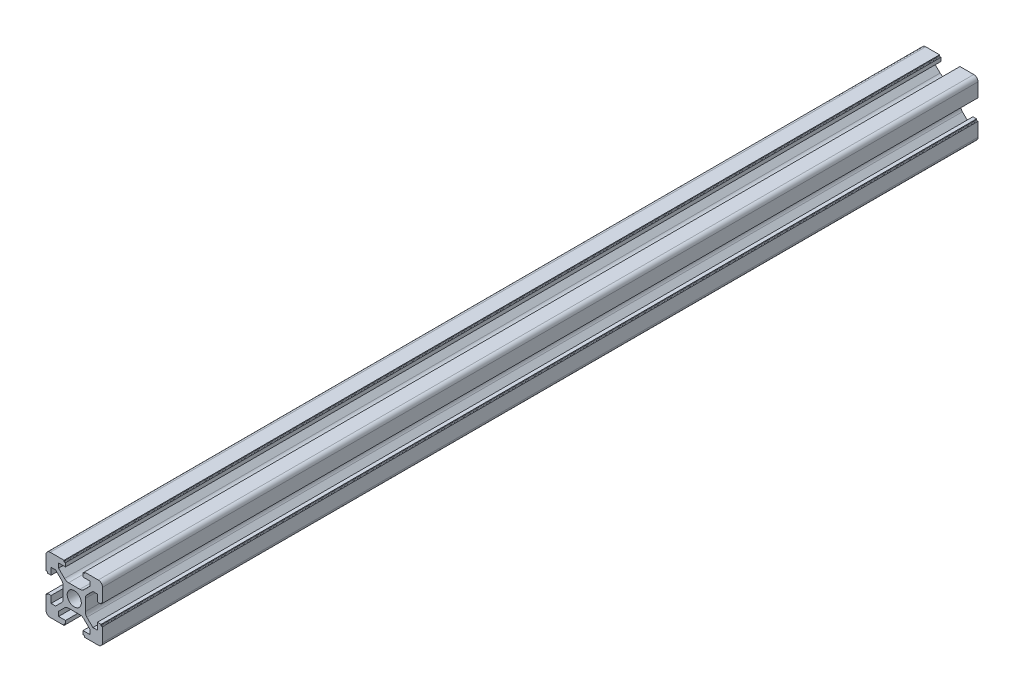
from build123d import *

# Parameters (mm, degrees)
SKETCH1_R       = 2.5
EXTRUDE_1_DEPTH = 310


with BuildPart() as part:
    # Sketch1 → Бобышка-Вытянуть1 (new body)
    with BuildSketch(Plane.XY):
        with BuildLine():
            Line((0, 3.9), (-2.010912703, 3.9))
            ThreePointArc((-2.010912703, 3.9), (-2.776279568, 4.052240935), (-3.425126266, 4.485786438))
            Line((-3.425126266, 4.485786438), (-5.539339828, 6.6))
            Line((-5.539339828, 6.6), (-5.539339828, 8.2))
            Line((-5.539339828, 8.2), (-3.1, 8.2))
            Line((-3.1, 8.2), (-3.1, 9.5))
            Line((-3.1, 9.5), (-3.4, 9.5))
            ThreePointArc((-3.4, 9.5), (-3.541421356, 9.558578644), (-3.6, 9.7))
            Line((-3.6, 9.7), (-3.6, 10))
            Line((-3.6, 10), (-8.5, 10))
            ThreePointArc((-8.5, 10), (-9.560660172, 9.560660172), (-10, 8.5))
            Line((-10, 8.5), (-10, 3.6))
            Line((-10, 3.6), (-9.7, 3.6))
            ThreePointArc((-9.7, 3.6), (-9.558578644, 3.541421356), (-9.5, 3.4))
            Line((-9.5, 3.4), (-9.5, 3.1))
            Line((-9.5, 3.1), (-8.2, 3.1))
            Line((-8.2, 3.1), (-8.2, 5.539339828))
            Line((-8.2, 5.539339828), (-6.6, 5.539339828))
            Line((-6.6, 5.539339828), (-4.485786438, 3.425126266))
            ThreePointArc((-4.485786438, 3.425126266), (-4.052240935, 2.776279568), (-3.9, 2.010912703))
            Line((-3.9, 2.010912703), (-3.9, 0))
            Line((-3.9, 0), (-3.9, -2.010912703))
            ThreePointArc((-3.9, -2.010912703), (-4.052240935, -2.776279568), (-4.485786438, -3.425126266))
            Line((-4.485786438, -3.425126266), (-6.6, -5.539339828))
            Line((-6.6, -5.539339828), (-8.2, -5.539339828))
            Line((-8.2, -5.539339828), (-8.2, -3.1))
            Line((-8.2, -3.1), (-9.5, -3.1))
            Line((-9.5, -3.1), (-9.5, -3.4))
            ThreePointArc((-9.5, -3.4), (-9.558578644, -3.541421356), (-9.7, -3.6))
            Line((-9.7, -3.6), (-10, -3.6))
            Line((-10, -3.6), (-10, -8.5))
            ThreePointArc((-10, -8.5), (-9.560660172, -9.560660172), (-8.5, -10))
            Line((-8.5, -10), (-3.6, -10))
            Line((-3.6, -10), (-3.6, -9.7))
            ThreePointArc((-3.6, -9.7), (-3.541421356, -9.558578644), (-3.4, -9.5))
            Line((-3.4, -9.5), (-3.1, -9.5))
            Line((-3.1, -9.5), (-3.1, -8.2))
            Line((-3.1, -8.2), (-5.539339828, -8.2))
            Line((-5.539339828, -8.2), (-5.539339828, -6.6))
            Line((-5.539339828, -6.6), (-3.425126266, -4.485786438))
            ThreePointArc((-3.425126266, -4.485786438), (-2.776279568, -4.052240935), (-2.010912703, -3.9))
            Line((-2.010912703, -3.9), (0, -3.9))
            Line((0, -3.9), (2.010912703, -3.9))
            ThreePointArc((2.010912703, -3.9), (2.776279568, -4.052240935), (3.425126266, -4.485786438))
            Line((3.425126266, -4.485786438), (5.539339828, -6.6))
            Line((5.539339828, -6.6), (5.539339828, -8.2))
            Line((5.539339828, -8.2), (3.1, -8.2))
            Line((3.1, -8.2), (3.1, -9.5))
            Line((3.1, -9.5), (3.4, -9.5))
            ThreePointArc((3.4, -9.5), (3.541421356, -9.558578644), (3.6, -9.7))
            Line((3.6, -9.7), (3.6, -10))
            Line((3.6, -10), (8.5, -10))
            ThreePointArc((8.5, -10), (9.560660172, -9.560660172), (10, -8.5))
            Line((10, -8.5), (10, -3.6))
            Line((10, -3.6), (9.7, -3.6))
            ThreePointArc((9.7, -3.6), (9.558578644, -3.541421356), (9.5, -3.4))
            Line((9.5, -3.4), (9.5, -3.1))
            Line((9.5, -3.1), (8.2, -3.1))
            Line((8.2, -3.1), (8.2, -5.539339828))
            Line((8.2, -5.539339828), (6.6, -5.539339828))
            Line((6.6, -5.539339828), (4.485786438, -3.425126266))
            ThreePointArc((4.485786438, -3.425126266), (4.052240935, -2.776279568), (3.9, -2.010912703))
            Line((3.9, -2.010912703), (3.9, 0))
            Line((3.9, 0), (3.9, 2.010912703))
            ThreePointArc((3.9, 2.010912703), (4.052240935, 2.776279568), (4.485786438, 3.425126266))
            Line((4.485786438, 3.425126266), (6.6, 5.539339828))
            Line((6.6, 5.539339828), (8.2, 5.539339828))
            Line((8.2, 5.539339828), (8.2, 3.1))
            Line((8.2, 3.1), (9.5, 3.1))
            Line((9.5, 3.1), (9.5, 3.4))
            ThreePointArc((9.5, 3.4), (9.558578644, 3.541421356), (9.7, 3.6))
            Line((9.7, 3.6), (10, 3.6))
            Line((10, 3.6), (10, 8.5))
            ThreePointArc((10, 8.5), (9.560660172, 9.560660172), (8.5, 10))
            Line((8.5, 10), (3.6, 10))
            Line((3.6, 10), (3.6, 9.7))
            ThreePointArc((3.6, 9.7), (3.541421356, 9.558578644), (3.4, 9.5))
            Line((3.4, 9.5), (3.1, 9.5))
            Line((3.1, 9.5), (3.1, 8.2))
            Line((3.1, 8.2), (5.539339828, 8.2))
            Line((5.539339828, 8.2), (5.539339828, 6.6))
            Line((5.539339828, 6.6), (3.425126266, 4.485786438))
            ThreePointArc((3.425126266, 4.485786438), (2.776279568, 4.052240935), (2.010912703, 3.9))
            Line((2.010912703, 3.9), (0, 3.9))
        make_face()
        Circle(SKETCH1_R, mode=Mode.SUBTRACT)
    extrude(amount=EXTRUDE_1_DEPTH)


solid = part.part
